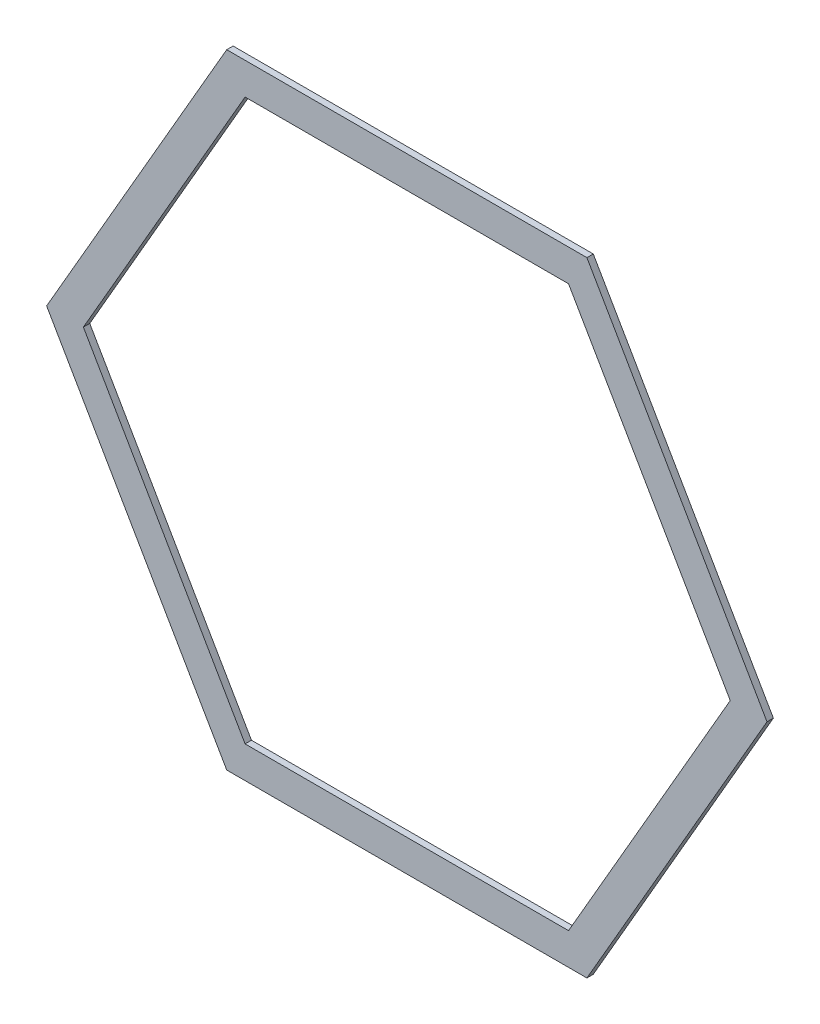
from build123d import *

# Parameters (mm, degrees)
BOSS_EXTRU_1_DEPTH = 1


with BuildPart() as part:
    # Esquisse1 → Boss.-Extru.1 (new body)
    with BuildSketch(Plane.XY):
        Polygon((56.580326381, 0), (28.29016319, 49), (-28.29016319, 49), (-56.580326381, 0), (-28.29016319, -49), (28.29016319, -49), align=None)
        Polygon((50.806823689, 0), (25.403411844, 44), (-25.403411844, 44), (-50.806823689, 0), (-25.403411844, -44), (25.403411844, -44), align=None, mode=Mode.SUBTRACT)
    extrude(amount=BOSS_EXTRU_1_DEPTH)


solid = part.part
